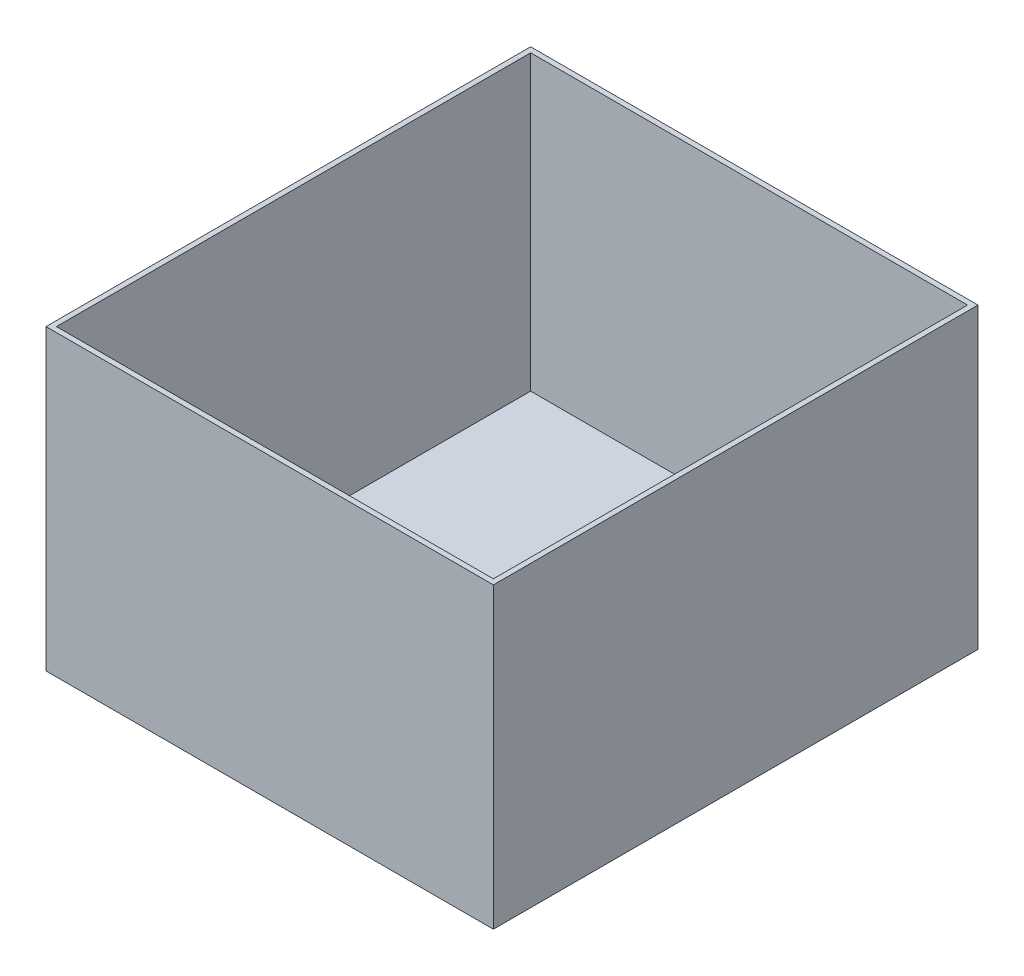
from build123d import *

# Parameters (mm, degrees)
SKETCH1_W           = 152.4
SKETCH1_H           = 165.1
BOSS_EXTRUDE1_DEPTH = 101.6
SKETCH2_W           = 148.844
SKETCH2_H           = 161.544
CUT_EXTRUDE1_DEPTH  = 99.822


with BuildPart() as part:
    # Sketch1 → Boss-Extrude1 (new body)
    with BuildSketch(Plane(origin=(0, 0, 0), x_dir=(1, 0, 0), z_dir=(0, 1, 0))):
        with Locations((76.2, 82.55)):
            Rectangle(SKETCH1_W, SKETCH1_H)
    extrude(amount=BOSS_EXTRUDE1_DEPTH)

    # Sketch2 → Cut-Extrude1 (cut)
    with BuildSketch(Plane(origin=(0, 101.6, 0), x_dir=(1, 0, 0), z_dir=(0, 1, 0))):
        with Locations((76.2, 82.55)):
            Rectangle(SKETCH2_W, SKETCH2_H)
    extrude(amount=-CUT_EXTRUDE1_DEPTH, mode=Mode.SUBTRACT)


solid = part.part
